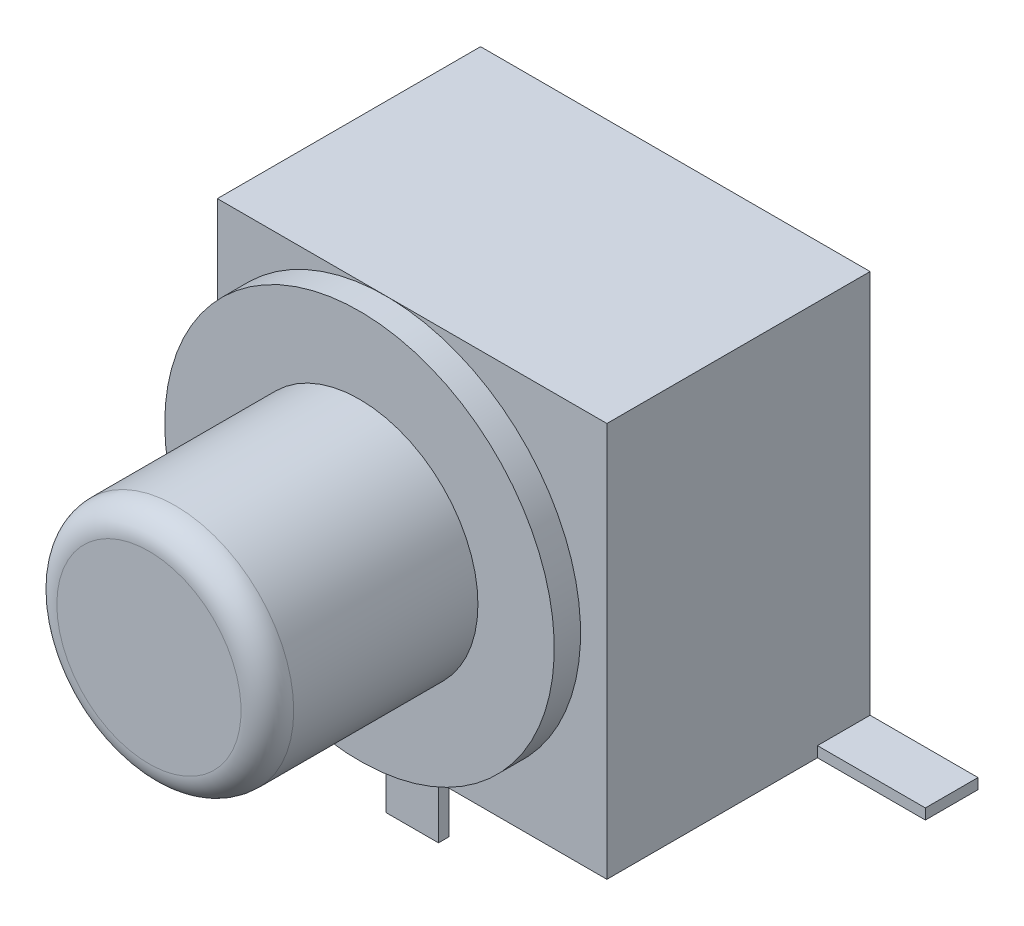
from build123d import *

# Parameters (mm, degrees)
SKETCH_1_W      = 7.4
SKETCH_1_H      = 7.5
EXTRUDE_1_DEPTH = 5
SKETCH_2_R      = 1.75
EXTRUDE_2_DEPTH = 2.2
FILLET_1_R      = 0.5
SKETCH_5_W      = 1
SKETCH_5_H      = 0.2
EXTRUDE_3_DEPTH = 2.05
SKETCH_6_W      = 1
SKETCH_6_H      = 0.2
EXTRUDE_4_DEPTH = 2.05
SKETCH_7_W      = 0.7
SKETCH_7_H      = 0.2
EXTRUDE_5_DEPTH = 1
SKETCH_8_W      = 1
SKETCH_8_H      = 0.2
EXTRUDE_6_DEPTH = 1


with BuildPart() as part:
    # 草图1 → 凸台-拉伸1 (new body)
    with BuildSketch(Plane.XY):
        Rectangle(SKETCH_1_W, SKETCH_1_H)
    extrude(amount=EXTRUDE_1_DEPTH)

    # 草图2 → 凸台-拉伸2 (add)
    with BuildSketch(Plane.XY.offset(5)):
        with Locations((0, 0.55)):
            Circle(SKETCH_2_R)
    extrude(amount=EXTRUDE_2_DEPTH)

    # 草图4 → 旋转1 (revolve)
    with BuildSketch(Plane(origin=(0, 0.55, 0), x_dir=(1, 0, 0), z_dir=(0, 1, 0)), mode=Mode.PRIVATE) as revolve_1_sk:
        Polygon((0, -5.5), (3.7, -5.5), (3.7, -6), (2.25, -6), (2.25, -10), (0, -10), align=None)
    revolve(revolve_1_sk.sketch.rotate(Axis((0, 0.55, -1.831178889), (0, 0, 1)), 180), axis=Axis((0, 0.55, -1.831178889), (0, 0, 1)))

    # 圆角1
    fillet_1_edges = [part.edges().sort_by_distance(p)[0] for p in [
        (2.25, 0.55, 10),
    ]]
    fillet(fillet_1_edges, radius=FILLET_1_R)

    # 草图5 → 凸台-拉伸3 (add)
    with BuildSketch(Plane(origin=(3.7, 0, 0), x_dir=(0, 0, -1), z_dir=(1, 0, 0))):
        with Locations((-0.5, -3.65)):
            Rectangle(SKETCH_5_W, SKETCH_5_H)
    extrude(amount=EXTRUDE_3_DEPTH)

    # 草图6 → 凸台-拉伸4 (add)
    with BuildSketch(Plane.ZY.offset(3.7)):
        with Locations((0.5, -3.65)):
            Rectangle(SKETCH_6_W, SKETCH_6_H)
    extrude(amount=EXTRUDE_4_DEPTH)

    # 草图7 → 凸台-拉伸5 (add)
    with BuildSketch(Plane(origin=(0, 0, 0), x_dir=(-1, 0, 0), z_dir=(0, 0, -1))):
        with Locations((-2.25, -3.65)):
            Rectangle(SKETCH_7_W, SKETCH_7_H)
        with Locations((2.25, -3.65)):
            Rectangle(SKETCH_7_W, SKETCH_7_H)
    extrude(amount=EXTRUDE_5_DEPTH)

    # 草图8 → 凸台-拉伸6 (add)
    with BuildSketch(Plane.XZ.offset(3.75)):
        with Locations((0, 4.9)):
            Rectangle(SKETCH_8_W, SKETCH_8_H)
    extrude(amount=EXTRUDE_6_DEPTH)


solid = part.part
